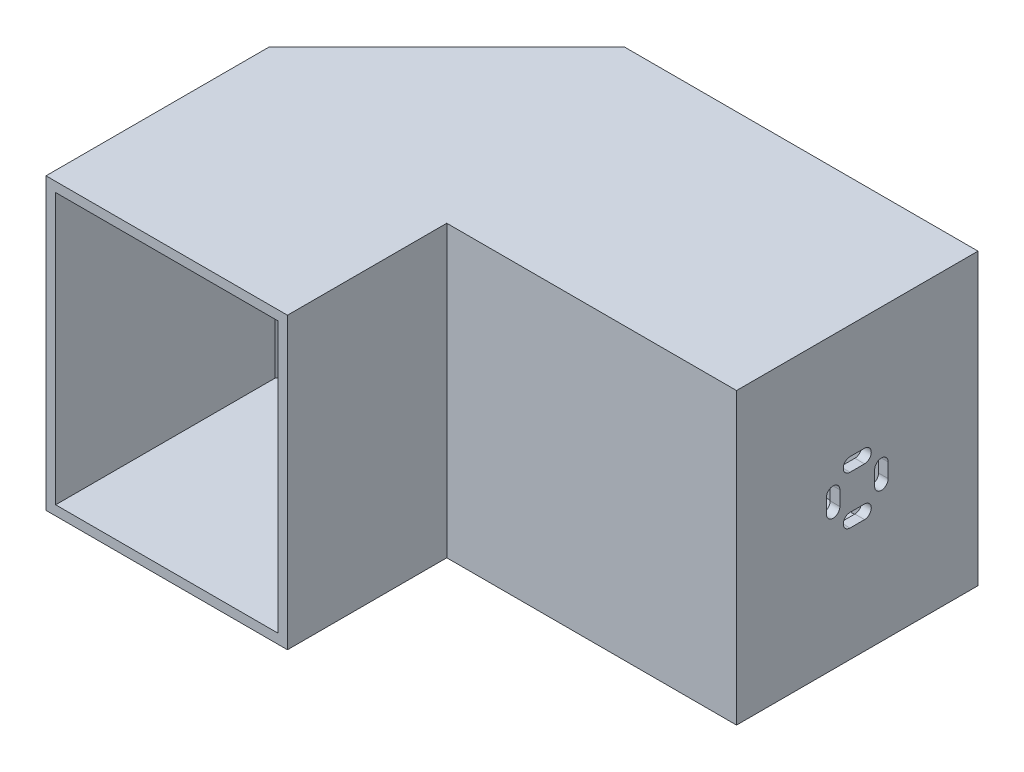
from build123d import *

# Parameters (mm, degrees)
BOSS_EXTRUDE1_DEPTH = 76.2
SHELL1_T            = -2.54
CUT_EXTRUDE1_DEPTH  = 2.54
CIRPATTERN1_COUNT   = 4


with BuildPart() as part:
    # Sketch1 → Boss-Extrude1 (new body)
    with BuildSketch(Plane(origin=(0, 0, 0), x_dir=(1, 0, 0), z_dir=(0, 1, 0))):
        Polygon((0, 0), (0, -41.892312512), (-63.5, -41.892312512), (-63.5, 16.822913885), (-16.822913885, 63.5), (76.2, 63.5), (76.2, 0), align=None)
    extrude(amount=BOSS_EXTRUDE1_DEPTH)

    # Shell1
    shell1_openings = [part.faces().sort_by_distance(p)[0] for p in [
        (-31.75, 38.1, 41.892312512),
    ]]
    offset(amount=SHELL1_T, openings=shell1_openings, kind=Kind.INTERSECTION)

    # Sketch4 → Cut-Extrude1 (cut)
    with BuildSketch(Plane(origin=(76.2, 0, 0), x_dir=(0, 0, -1), z_dir=(1, 0, 0))):
        with BuildLine():
            Line((29.845, 46.228), (33.655, 46.228))
            ThreePointArc((33.655, 46.228), (35.433, 44.45), (33.655, 42.672))
            Line((33.655, 42.672), (29.845, 42.672))
            ThreePointArc((29.845, 42.672), (28.067, 44.45), (29.845, 46.228))
        make_face()
    cut_extrude1 = extrude(amount=-CUT_EXTRUDE1_DEPTH, mode=Mode.SUBTRACT)

    # CirPattern1: Cut-Extrude1 ×4 about axis
    cirpattern1_axis = Axis((76.2, 38.1, -31.75), (1, 0, 0))
    for i in range(1, CIRPATTERN1_COUNT):
        add(cut_extrude1.rotate(cirpattern1_axis, i * 360 / CIRPATTERN1_COUNT), mode=Mode.SUBTRACT)


solid = part.part
